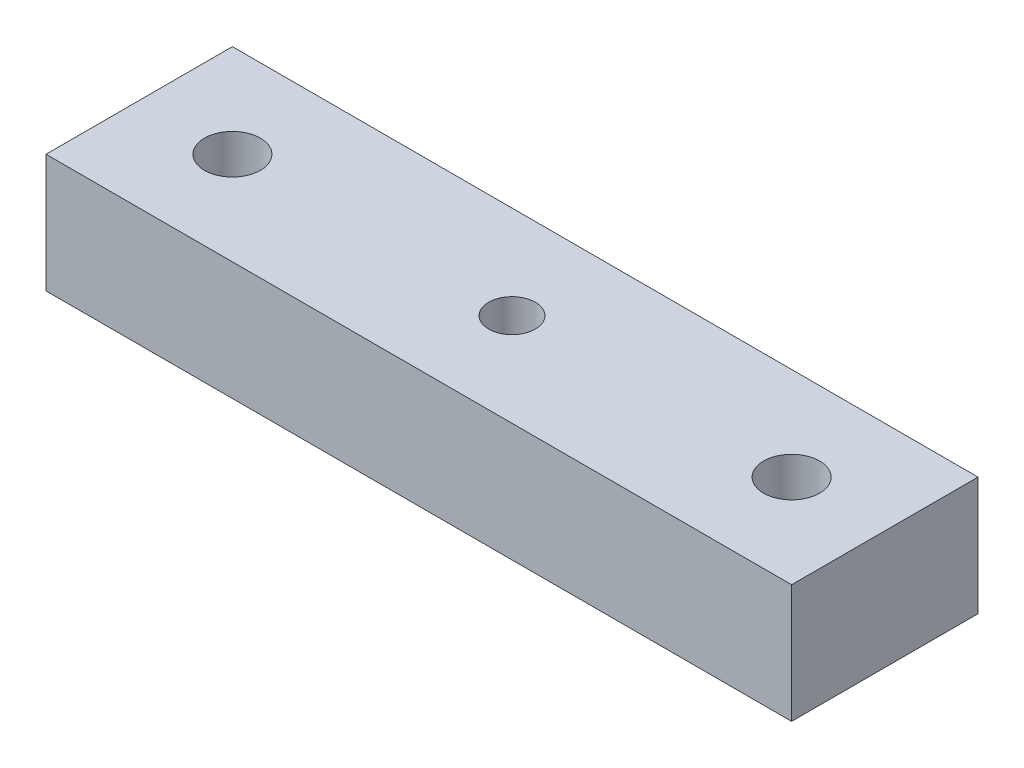
from build123d import *

# Parameters (mm, degrees)
SKETCH1_W           = 80
SKETCH1_H           = 20
SKETCH1_R           = 2.5
SKETCH1_R_2         = 3
BOSS_EXTRUDE1_DEPTH = 6.35


with BuildPart() as part:
    # Sketch1 → Boss-Extrude1 (new, symmetric)
    with BuildSketch(Plane(origin=(0, 0, 0), x_dir=(1, 0, 0), z_dir=(0, 1, 0))):
        Rectangle(SKETCH1_W, SKETCH1_H)
        with Locations(Location((0, 0, 0), (0, 0, 270))):
            Circle(SKETCH1_R, mode=Mode.SUBTRACT)
        with Locations(Location((-30, 0, 0), (0, 0, 270))):
            Circle(SKETCH1_R_2, mode=Mode.SUBTRACT)
        with Locations(Location((30, 0, 0), (0, 0, 270))):
            Circle(SKETCH1_R_2, mode=Mode.SUBTRACT)
    extrude(amount=BOSS_EXTRUDE1_DEPTH, both=True)


solid = part.part
